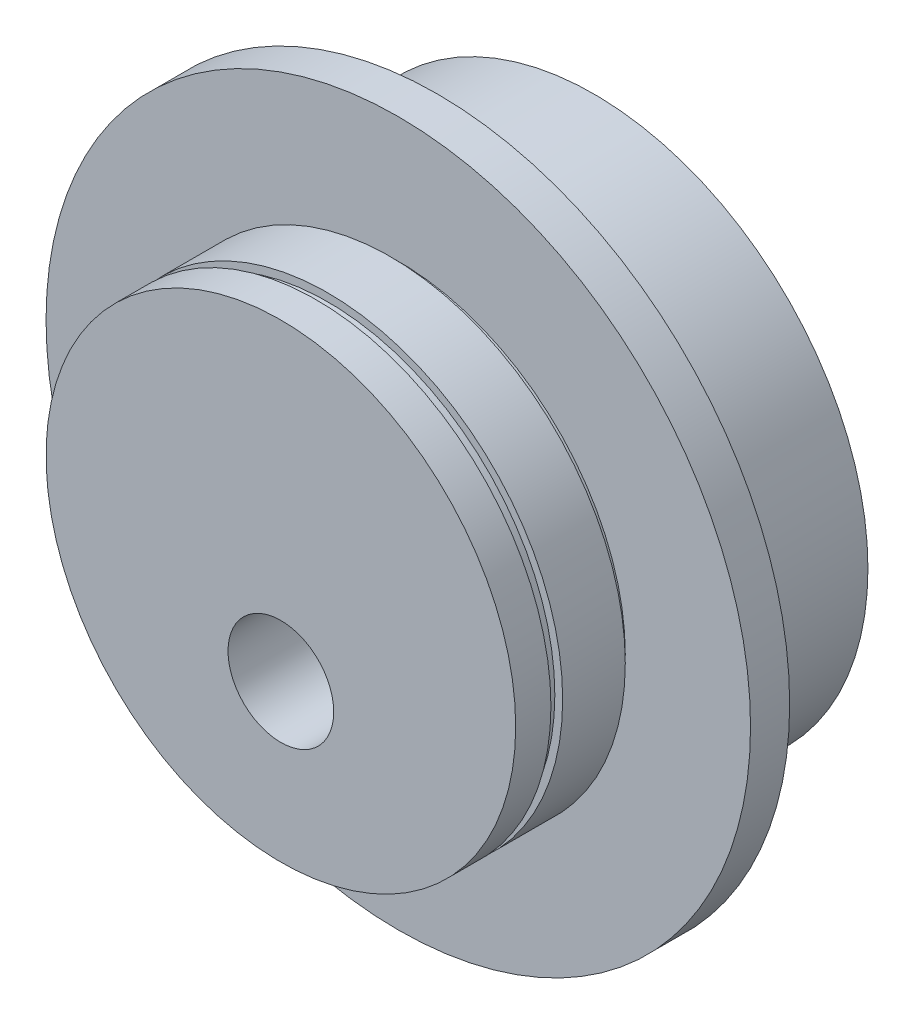
from build123d import *

# Parameters (mm, degrees)
SKETCH1_R               = 44.45
BOSS_EXTRUDE1_DEPTH     = 25.4
SKETCH2_R               = 36.83
BOSS_EXTRUDE2_DEPTH     = 25.4
SKETCH7_R               = 38.1
BOSS_EXTRUDE3_DEPTH     = 5.715
BOSS_EXTRUDE4_START     = -5.715
SKETCH8_R               = 38.1
BOSS_EXTRUDE4_DEPTH     = 5.715
BOSS_EXTRUDE6_START     = 7.62
SKETCH11_R              = 38.1
BOSS_EXTRUDE6_DEPTH     = 10.16
SKETCH12_R              = 57.15
BOSS_EXTRUDE7_DEPTH     = 6.35
CUT_EXTRUDE1_DEPTH      = 96.461432003
CUT_EXTRUDE1_DEPTH_BACK = 96.461432003
SKETCH3_R               = 8.5725


with BuildPart() as part:
    # Sketch1 → Boss-Extrude1 (new body)
    with BuildSketch(Plane.XY):
        Circle(SKETCH1_R)
    extrude(amount=BOSS_EXTRUDE1_DEPTH)

    # Sketch2 → Boss-Extrude2 (add)
    with BuildSketch(Plane.XY.offset(25.4)):
        Circle(SKETCH2_R)
    extrude(amount=BOSS_EXTRUDE2_DEPTH)

    # Sketch7 → Boss-Extrude3 (add)
    with BuildSketch(Plane.XY.offset(25.4)):
        Circle(SKETCH7_R)
    extrude(amount=BOSS_EXTRUDE3_DEPTH)

    # Sketch8 → Boss-Extrude4 (add)
    with BuildSketch(Plane.XY.offset(50.8).offset(BOSS_EXTRUDE4_START)):
        Circle(SKETCH8_R)
    extrude(amount=BOSS_EXTRUDE4_DEPTH)

    # Sketch11 → Boss-Extrude6 (add)
    with BuildSketch(Plane.XY.offset(25.4).offset(BOSS_EXTRUDE6_START)):
        Circle(SKETCH11_R)
    extrude(amount=BOSS_EXTRUDE6_DEPTH)

    # Sketch12 → Boss-Extrude7 (add)
    with BuildSketch(Plane.XY.offset(25.4)):
        Circle(SKETCH12_R)
    extrude(amount=BOSS_EXTRUDE7_DEPTH)

    # Sketch3 → Cut-Extrude1 (cut, two sides: drawn at the far end of the back side and taken through both)
    with BuildSketch(Plane.XY.offset(50.8).offset(-CUT_EXTRUDE1_DEPTH_BACK)):
        with Locations((0, -12.7)):
            Circle(SKETCH3_R)
    extrude(amount=CUT_EXTRUDE1_DEPTH + CUT_EXTRUDE1_DEPTH_BACK, mode=Mode.SUBTRACT)


solid = part.part
